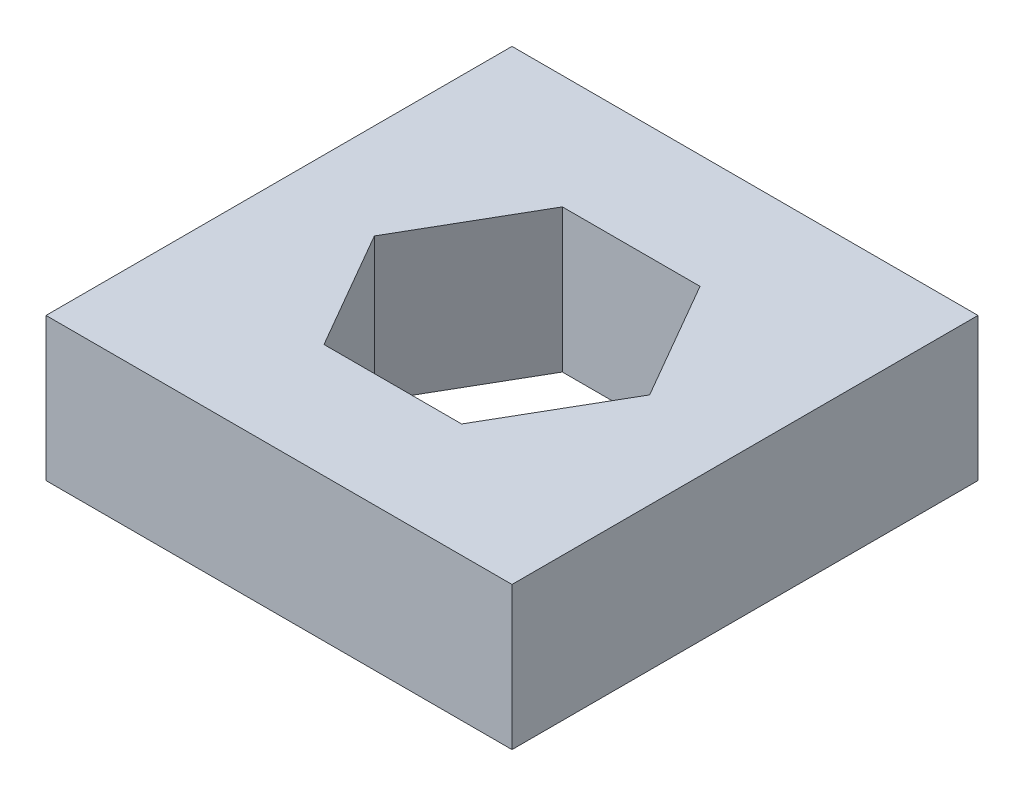
from build123d import *

# Parameters (mm, degrees)
ESBO_O1_W                = 9.773502692
ESBO_O1_H                = 9.773502692
RESSALTO_EXTRUS_O1_DEPTH = 3


with BuildPart() as part:
    # Esboço1 → Ressalto-extrusão1 (new body)
    with BuildSketch(Plane(origin=(0, 0, 0), x_dir=(1, 0, 0), z_dir=(0, 1, 0))):
        Rectangle(ESBO_O1_W, ESBO_O1_H)
        Polygon((1.443375673, 2.5), (-1.443375673, 2.5), (-2.886751346, 0), (-1.443375673, -2.5), (1.443375673, -2.5), (2.886751346, 0), align=None, mode=Mode.SUBTRACT)
    extrude(amount=RESSALTO_EXTRUS_O1_DEPTH)


solid = part.part
